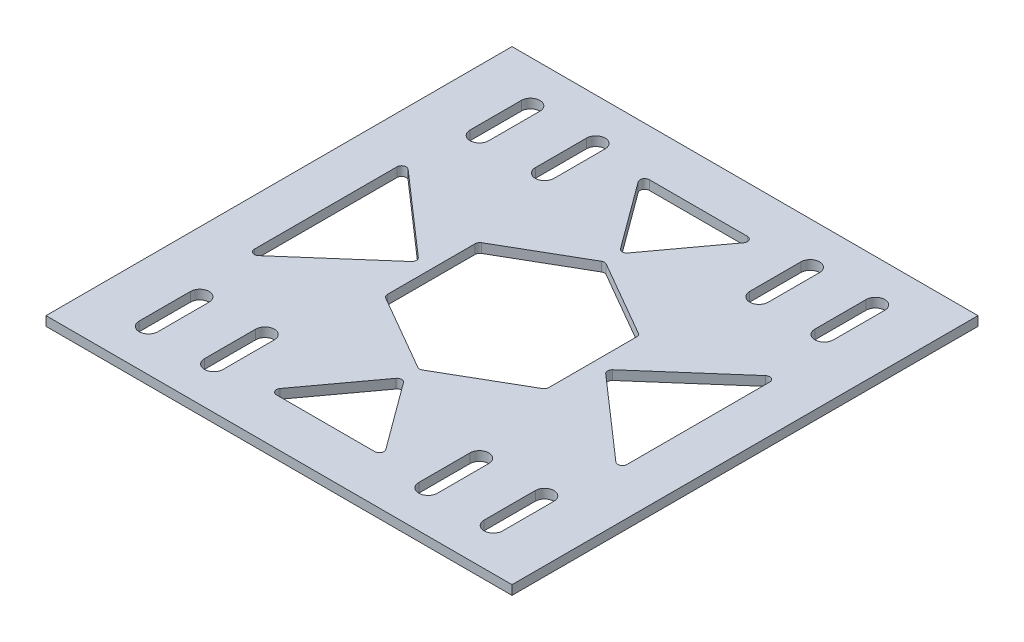
from build123d import *

# Parameters (mm, degrees)
SKETCH1_W           = 100
SKETCH1_H           = 100
BOSS_EXTRUDE1_DEPTH = 2
FILLET1_R           = 1
FILLET2_R           = 1
CUT_EXTRUDE1_DEPTH  = 142.435497666


with BuildPart() as part:
    # Sketch1 → Boss-Extrude1 (new body)
    with BuildSketch(Plane(origin=(0, 0, 0), x_dir=(1, 0, 0), z_dir=(0, 1, 0))):
        with Locations((50, 50)):
            Rectangle(SKETCH1_W, SKETCH1_H)
        Polygon((10, 67.5), (30, 50), (10, 32.5), (10, 50), align=None, mode=Mode.SUBTRACT)
        Polygon((50, 30), (67.320508076, 40), (67.320508076, 60), (50, 70), (32.679491924, 60), (32.679491924, 40), align=None, mode=Mode.SUBTRACT)
        Polygon((90, 50), (90, 67.5), (70, 50), (90, 32.5), align=None, mode=Mode.SUBTRACT)
        Polygon((50, 10), (62.5, 10), (50, 27), (37.5, 10), align=None, mode=Mode.SUBTRACT)
        Polygon((50, 90), (62.5, 90), (50, 73), (37.5, 90), align=None, mode=Mode.SUBTRACT)
    extrude(amount=BOSS_EXTRUDE1_DEPTH)

    # Fillet1
    fillet1_edges = [part.edges().sort_by_distance(p)[0] for p in [
        (32.679491924, 1, -60),
        (50, 1, -70),
        (50, 1, -30),
        (67.320508076, 1, -40),
        (32.679491924, 1, -40),
        (67.320508076, 1, -60),
    ]]
    fillet(fillet1_edges, radius=FILLET1_R)

    # Fillet2
    fillet2_edges = [part.edges().sort_by_distance(p)[0] for p in [
        (50, 1, -73),
        (37.5, 1, -10),
        (10, 1, -32.5),
        (62.5, 1, -10),
        (90, 1, -32.5),
        (90, 1, -67.5),
        (62.5, 1, -90),
        (37.5, 1, -90),
        (10, 1, -67.5),
        (50, 1, -27),
        (30, 1, -50),
        (70, 1, -50),
    ]]
    fillet(fillet2_edges, radius=FILLET2_R)

    # Sketch2 → Cut-Extrude1 (cut, through all)
    with BuildSketch(Plane(origin=(0, 2, 0), x_dir=(1, 0, 0), z_dir=(0, 1, 0))):
        with BuildLine():
            Line((29, 80), (29, 91))
            ThreePointArc((29, 91), (27, 93), (25, 91))
            Line((25, 91), (25, 80))
            ThreePointArc((25, 80), (27, 78), (29, 80))
        make_face()
        with BuildLine():
            Line((15, 80), (15, 91))
            ThreePointArc((15, 91), (13, 93), (11, 91))
            Line((11, 91), (11, 80))
            ThreePointArc((11, 80), (13, 78), (15, 80))
        make_face()
        with BuildLine():
            ThreePointArc((75, 91), (73, 93), (71, 91))
            Line((71, 91), (71, 80))
            ThreePointArc((71, 80), (73, 78), (75, 80))
            Line((75, 80), (75, 91))
        make_face()
        with BuildLine():
            ThreePointArc((89, 91), (87, 93), (85, 91))
            Line((85, 91), (85, 80))
            ThreePointArc((85, 80), (87, 78), (89, 80))
            Line((89, 80), (89, 91))
        make_face()
        with BuildLine():
            ThreePointArc((25, 9), (27, 7), (29, 9))
            Line((29, 9), (29, 20))
            ThreePointArc((29, 20), (27, 22), (25, 20))
            Line((25, 20), (25, 9))
        make_face()
        with BuildLine():
            ThreePointArc((11, 9), (13, 7), (15, 9))
            Line((15, 9), (15, 20))
            ThreePointArc((15, 20), (13, 22), (11, 20))
            Line((11, 20), (11, 9))
        make_face()
        with BuildLine():
            Line((71, 20), (71, 9))
            ThreePointArc((71, 9), (73, 7), (75, 9))
            Line((75, 9), (75, 20))
            ThreePointArc((75, 20), (73, 22), (71, 20))
        make_face()
        with BuildLine():
            Line((85, 20), (85, 9))
            ThreePointArc((85, 9), (87, 7), (89, 9))
            Line((89, 9), (89, 20))
            ThreePointArc((89, 20), (87, 22), (85, 20))
        make_face()
    extrude(amount=-CUT_EXTRUDE1_DEPTH, mode=Mode.SUBTRACT)


solid = part.part
